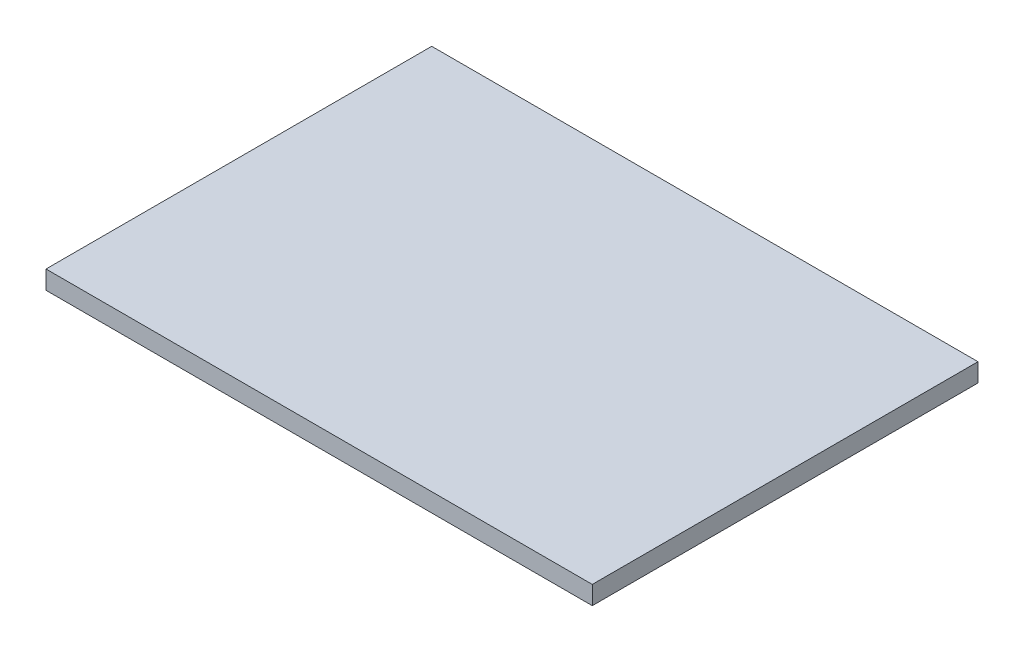
from build123d import *

# Parameters (mm, degrees)
SKETCH2_W      = 296
SKETCH2_H      = 209
EXTRUDE1_DEPTH = 10


with BuildPart() as part:
    # Sketch2 → Extrude1 (new body)
    with BuildSketch(Plane(origin=(0, 0, 0), x_dir=(1, 0, 0), z_dir=(0, 1, 0))):
        Rectangle(SKETCH2_W, SKETCH2_H)
    extrude(amount=EXTRUDE1_DEPTH)


solid = part.part
